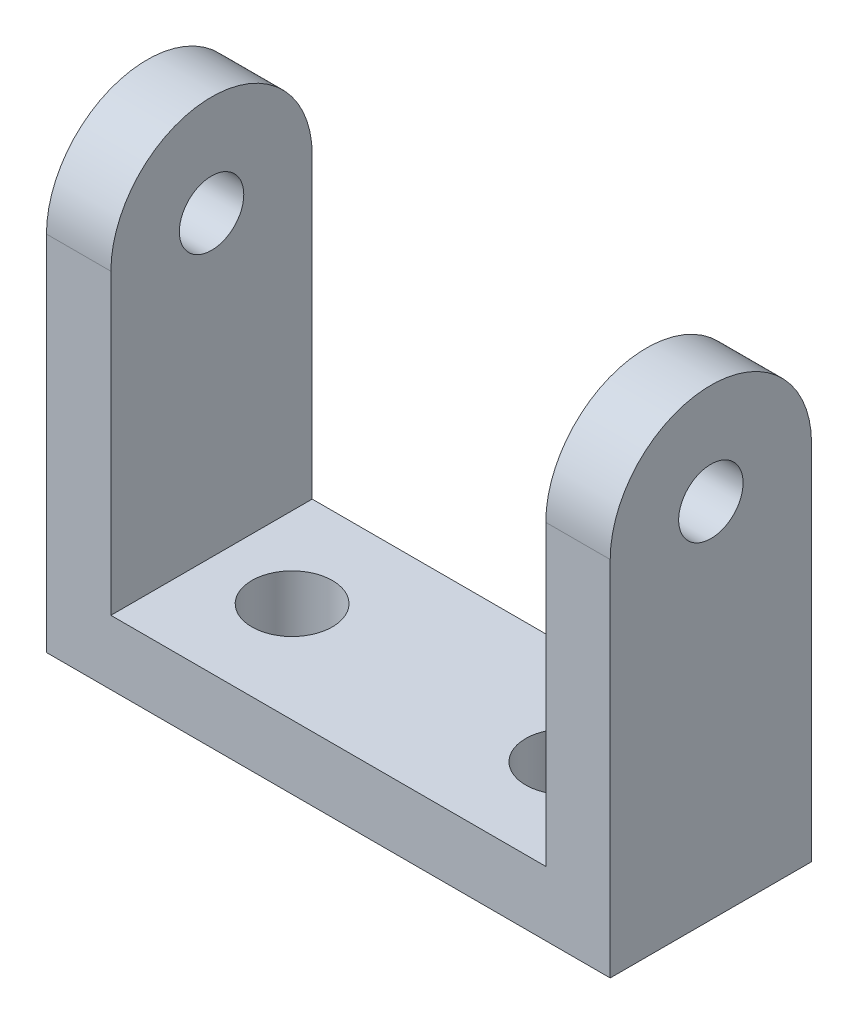
from build123d import *

# Parameters (mm, degrees)
ESTRUSIONE_ESTRUSIONE1_DEPTH  = 12.5
ESTRUSIONE_ESTRUSIONE2_START  = 27
SCHIZZO2_R                    = 12.5
ESTRUSIONE_ESTRUSIONE2_DEPTH  = 8
TAGLIO_ESTRUSIONE1_DEPTH      = 69.465319688
TAGLIO_ESTRUSIONE1_DEPTH_BACK = 69.465319688
SCHIZZO3_R                    = 4
SCHIZZO4_R                    = 5
TAGLIO_ESTRUSIONE2_DEPTH      = 62.899111464


with BuildPart() as part:
    # Schizzo1 → Estrusione-Estrusione1 (new, symmetric)
    with BuildSketch(Plane.XY):
        Polygon((-35, 0), (35, 0), (35, 45), (27, 45), (27, 8), (-27, 8), (-27, 45), (-35, 45), align=None)
    extrude(amount=ESTRUSIONE_ESTRUSIONE1_DEPTH, both=True)

    # Schizzo2 → Estrusione-Estrusione2 (add)
    with BuildSketch(Plane(origin=(0, 0, 0), x_dir=(0, 0, -1), z_dir=(1, 0, 0)).offset(ESTRUSIONE_ESTRUSIONE2_START)):
        with Locations((0, 45)):
            Circle(SCHIZZO2_R)
    estrusione_estrusione2 = extrude(amount=ESTRUSIONE_ESTRUSIONE2_DEPTH)

    # Specchia1: Estrusione-Estrusione2 across plane
    add(estrusione_estrusione2.mirror(Plane(origin=(0, 0, 0), x_dir=(0, 0, 1), z_dir=(1, 0, 0))))

    # Schizzo3 → Taglio-Estrusione1 (cut, two sides: drawn at the far end of the back side and taken through both)
    with BuildSketch(Plane(origin=(0, 0, 0), x_dir=(0, 0, -1), z_dir=(1, 0, 0)).offset(-TAGLIO_ESTRUSIONE1_DEPTH_BACK)):
        with Locations((0, 45)):
            Circle(SCHIZZO3_R)
    extrude(amount=TAGLIO_ESTRUSIONE1_DEPTH + TAGLIO_ESTRUSIONE1_DEPTH_BACK, mode=Mode.SUBTRACT)

    # Schizzo4 → Taglio-Estrusione2 (cut, through all)
    with BuildSketch(Plane(origin=(0, 8, 0), x_dir=(1, 0, 0), z_dir=(0, 1, 0))):
        with Locations(Location((-17, 0, 0), (0, 0, 180))):
            Circle(SCHIZZO4_R)
        with Locations(Location((17, 0, 0), (0, 0, 180))):
            Circle(SCHIZZO4_R)
    extrude(amount=-TAGLIO_ESTRUSIONE2_DEPTH, mode=Mode.SUBTRACT)


solid = part.part
